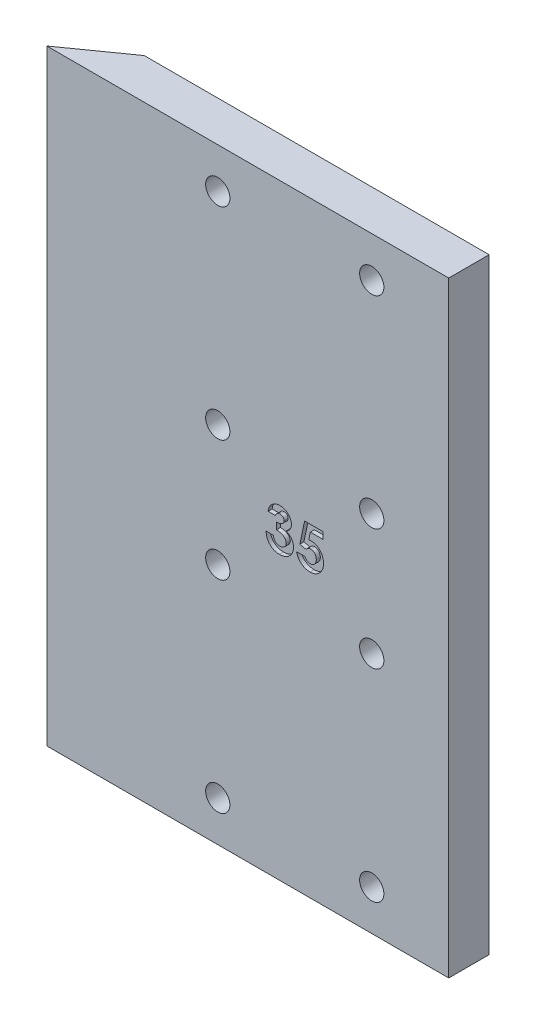
from build123d import *

# Parameters (mm, degrees)
SKETCH1_R           = 3
BOSS_EXTRUDE1_DEPTH = 10
BOSS_EXTRUDE2_DEPTH = 150
CUT_EXTRUDE1_DEPTH  = 1


with BuildPart() as part:
    # Sketch1 → Boss-Extrude1 (new body)
    with BuildSketch(Plane.XY):
        Polygon((38.1, -75), (38.1, 75), (0, 75), (-38.1, 75), (-38.1, -75), (0, -75), align=None)
        with Locations((19.05, 65)):
            Circle(SKETCH1_R, mode=Mode.SUBTRACT)
        with Locations((19.05, 15)):
            Circle(SKETCH1_R, mode=Mode.SUBTRACT)
        with Locations(Location((-19.05, 15, 0), (0, 0, 180))):
            Circle(SKETCH1_R, mode=Mode.SUBTRACT)
        with Locations(Location((-19.05, 65, 0), (0, 0, 180))):
            Circle(SKETCH1_R, mode=Mode.SUBTRACT)
        with Locations(Location((19.05, -65, 0), (0, 0, 180))):
            Circle(SKETCH1_R, mode=Mode.SUBTRACT)
        with Locations(Location((19.05, -15, 0), (0, 0, 180))):
            Circle(SKETCH1_R, mode=Mode.SUBTRACT)
        with Locations((-19.05, -15)):
            Circle(SKETCH1_R, mode=Mode.SUBTRACT)
        with Locations((-19.05, -65)):
            Circle(SKETCH1_R, mode=Mode.SUBTRACT)
    extrude(amount=BOSS_EXTRUDE1_DEPTH)

    # Sketch2 → Boss-Extrude2 (add)
    with BuildSketch(Plane.XZ.offset(75)):
        Polygon((-47.255067051, 0), (-61.346613835, 10), (-38.1, 10), (-38.1, 0), align=None)
    extrude(amount=-BOSS_EXTRUDE2_DEPTH)

    # Sketch3 → Cut-Extrude1 (cut)
    with BuildSketch(Plane.XY.offset(10)):
        with BuildLine():
            Line((-4.80565485, 2.66317523), (-6.600526645, 2.66317523))
            add(Edge.make_bspline(
                [(-6.600526645, 2.66317523), (-6.587854167, 2.752894468), (-6.563010615, 2.928783091), (-6.503563316, 3.183426), (-6.432457931, 3.424972227), (-6.343686491, 3.652656844), (-6.239572034, 3.866885432), (-6.121173288, 4.068393119), (-5.987210317, 4.256314997), (-5.884526281, 4.369519882), (-5.833299081, 4.425995743)],
                knots=[0, 0, 0, 0, 1.111473889, 2.178970933, 3.205615836, 4.199322666, 5.174200091, 6.12565194, 7.064921805, 8, 8, 8, 8], degree=3))
            add(Edge.make_bspline(
                [(-5.833299081, 4.425995743), (-5.759410632, 4.500511549), (-5.613784266, 4.647374371), (-5.370425529, 4.835489423), (-5.115340629, 4.998290208), (-4.843413728, 5.127359848), (-4.558876213, 5.231826769), (-4.259465342, 5.301997435), (-3.946404618, 5.348556292), (-3.732780057, 5.353142502), (-3.623763824, 5.355482922)],
                knots=[0, 0, 0, 0, 1.01925491, 2.00884431, 2.983262333, 3.955970413, 4.92937149, 5.924503185, 6.940838805, 8, 8, 8, 8], degree=3))
            add(Edge.make_bspline(
                [(-3.623763824, 5.355482922), (-3.526842784, 5.353194807), (-3.336315548, 5.348696832), (-3.056288452, 5.312589532), (-2.78930605, 5.249261349), (-2.532546261, 5.16646117), (-2.289785184, 5.053797689), (-2.055664848, 4.923019367), (-1.836726582, 4.76261432), (-1.632458112, 4.58137276), (-1.444798564, 4.385342271), (-1.282284573, 4.175801799), (-1.142568379, 3.958348654), (-1.027460715, 3.731176211), (-0.938958564, 3.493900067), (-0.877535447, 3.247890934), (-0.837332525, 2.99369165), (-0.833327263, 2.82091582), (-0.831295875, 2.73328741)],
                knots=[0, 0, 0, 0, 1.091422571, 2.145516843, 3.172569842, 4.178562979, 5.178154469, 6.181868002, 7.194278174, 8.227918432, 9.254613415, 10.245994977, 11.209837596, 12.161663635, 13.10878368, 14.055455738, 15.013766427, 16, 16, 16, 16], degree=3))
            add(Edge.make_bspline(
                [(-0.831295875, 2.73328741), (-0.835464405, 2.62476692), (-0.843670957, 2.411123439), (-0.911011658, 2.098440333), (-1.016418167, 1.799459482), (-1.168688121, 1.518364079), (-1.359064347, 1.255919109), (-1.5926496, 1.020898893), (-1.862790766, 0.809618633), (-2.065589337, 0.696076596), (-2.169436901, 0.637934845)],
                knots=[0, 0, 0, 0, 0.992805628, 1.954529043, 2.915727527, 3.886831945, 4.871318353, 5.87440735, 6.911542536, 8, 8, 8, 8], degree=3))
            add(Edge.make_bspline(
                [(-2.169436901, 0.637934845), (-2.098157526, 0.614532326), (-1.958096751, 0.568547425), (-1.759017201, 0.477980682), (-1.569715297, 0.379006244), (-1.39345075, 0.264024037), (-1.228470395, 0.137683433), (-1.075779974, -0.001095574), (-0.934467196, -0.152010381), (-0.806838935, -0.315890962), (-0.693563866, -0.490116366), (-0.591928179, -0.670662089), (-0.508276343, -0.860266141), (-0.437412823, -1.056763114), (-0.383461374, -1.261919021), (-0.345474733, -1.474938898), (-0.323517522, -1.695336834), (-0.320168673, -1.844656302), (-0.318475363, -1.920158103)],
                knots=[0, 0, 0, 0, 1.059543567, 2.081955587, 3.086750234, 4.076226789, 5.052108497, 6.020845489, 6.989030705, 7.970690546, 8.952259656, 9.923888338, 10.895517021, 11.877585046, 12.873342345, 13.889638361, 14.932918083, 16, 16, 16, 16], degree=3))
            add(Edge.make_bspline(
                [(-0.318475363, -1.920158103), (-0.321907929, -2.031115096), (-0.328676252, -2.249899688), (-0.37170608, -2.572147002), (-0.451819866, -2.879381186), (-0.55721399, -3.175137432), (-0.697798312, -3.455597636), (-0.863242424, -3.727197975), (-1.06660648, -3.980519426), (-1.292610709, -4.22225915), (-1.543601581, -4.442038084), (-1.815716518, -4.632576529), (-2.102971947, -4.796092416), (-2.40718525, -4.928839272), (-2.728250738, -5.031069533), (-3.065452783, -5.104966279), (-3.420208217, -5.15017753), (-3.662356556, -5.154917072), (-3.78602344, -5.15733759)],
                knots=[0, 0, 0, 0, 1.005138573, 1.981928558, 2.936866704, 3.876260664, 4.820238198, 5.773547, 6.751179199, 7.756627054, 8.768222608, 9.766606018, 10.760583154, 11.757261445, 12.767156078, 13.807575856, 14.880313354, 16, 16, 16, 16], degree=3))
            add(Edge.make_bspline(
                [(-3.78602344, -5.15733759), (-3.903010317, -5.154785563), (-4.131762676, -5.149795412), (-4.466360875, -5.106603123), (-4.784364792, -5.036930455), (-5.086585977, -4.938721053), (-5.371855162, -4.811360242), (-5.642759276, -4.659702093), (-5.89389249, -4.474999316), (-6.128052921, -4.265589744), (-6.340046185, -4.030644094), (-6.529518239, -3.775604766), (-6.692291193, -3.49950195), (-6.829032579, -3.203515272), (-6.938673389, -2.887125482), (-7.025157738, -2.550975975), (-7.085568472, -2.194410019), (-7.103966687, -1.949085056), (-7.113347158, -1.824004257)],
                knots=[0, 0, 0, 0, 1.066544725, 2.085487077, 3.070979577, 4.031932826, 4.977951092, 5.916076795, 6.857635327, 7.814973522, 8.776389752, 9.738577119, 10.707772778, 11.69409279, 12.707140348, 13.757286496, 14.856535458, 16, 16, 16, 16], degree=3))
            Line((-7.113347158, -1.824004257), (-5.318475363, -1.824004257))
            add(Edge.make_bspline(
                [(-5.318475363, -1.824004257), (-5.307101447, -1.886896525), (-5.284947764, -2.009395709), (-5.241738364, -2.186747296), (-5.185430488, -2.350453765), (-5.120324573, -2.501970134), (-5.050000383, -2.643285761), (-4.965031945, -2.76918151), (-4.8716453, -2.883075967), (-4.73688769, -3.018474952), (-4.544242404, -3.157591758), (-4.284107446, -3.278490879), (-3.99473194, -3.349352618), (-3.792429601, -3.357997533), (-3.687866388, -3.362465796)],
                knots=[0, 0, 0, 0, 0.928156231, 1.807827665, 2.648129825, 3.438902246, 4.202261636, 4.936546065, 5.639352463, 6.338805438, 7.70633318, 9.064371875, 10.482673459, 12, 12, 12, 12], degree=3))
            add(Edge.make_bspline(
                [(-3.687866388, -3.362465796), (-3.632381452, -3.361514321), (-3.523698874, -3.359650595), (-3.36406035, -3.338993692), (-3.211982179, -3.304971756), (-3.067181107, -3.258737206), (-2.928735322, -3.200779307), (-2.799289968, -3.126046064), (-2.676206626, -3.039158001), (-2.560823325, -2.941472752), (-2.454206776, -2.835030799), (-2.365495538, -2.717164419), (-2.284419885, -2.597391112), (-2.224455748, -2.467874883), (-2.171914246, -2.335585091), (-2.139756162, -2.195720031), (-2.1154745, -2.051213694), (-2.114063347, -1.952319901), (-2.113347158, -1.902129257)],
                knots=[0, 0, 0, 0, 1.110435564, 2.175094844, 3.216326037, 4.226890168, 5.215276772, 6.21526065, 7.213097102, 8.228249917, 9.239874822, 10.221364777, 11.178138315, 12.128914389, 13.072518965, 14.022636769, 14.996447288, 16, 16, 16, 16], degree=3))
            add(Edge.make_bspline(
                [(-2.113347158, -1.902129257), (-2.115248506, -1.847237237), (-2.119033655, -1.737959802), (-2.149958716, -1.578492363), (-2.198795925, -1.42509754), (-2.266636773, -1.278454636), (-2.357230664, -1.139104148), (-2.464130446, -1.004250283), (-2.595758052, -0.880911945), (-2.740171164, -0.758995736), (-2.907633641, -0.652721571), (-3.089989826, -0.554646132), (-3.292032322, -0.476608361), (-3.508829092, -0.406906177), (-3.744481048, -0.355996784), (-3.99752488, -0.319031603), (-4.267552391, -0.291516755), (-4.453685864, -0.287569297), (-4.549244593, -0.285542719)],
                knots=[0, 0, 0, 0, 0.809814727, 1.612155564, 2.388397, 3.182215007, 3.988903953, 4.837162975, 5.715530372, 6.646997145, 7.623086902, 8.637258368, 9.698941581, 10.815059213, 11.996518529, 13.252603015, 14.589518788, 16, 16, 16, 16], degree=3))
            Line((-4.549244593, -0.285542719), (-4.549244593, 1.381123948))
            add(Edge.make_bspline(
                [(-4.549244593, 1.381123948), (-4.430268292, 1.391256351), (-4.207687193, 1.410212069), (-3.898732693, 1.454540676), (-3.638632831, 1.513793157), (-3.4211361, 1.585278069), (-3.240540751, 1.677083319), (-3.082773652, 1.778432262), (-2.946897163, 1.896134247), (-2.832063302, 2.026679417), (-2.740199787, 2.166872688), (-2.675184142, 2.314535042), (-2.632251207, 2.465097622), (-2.628183315, 2.568077889), (-2.62616767, 2.619104717)],
                knots=[0, 0, 0, 0, 1.70044513, 3.18119609, 4.440695891, 5.496282586, 6.431922213, 7.318171381, 8.16090191, 8.983045123, 9.787564368, 10.536848927, 11.275007137, 12, 12, 12, 12], degree=3))
            add(Edge.make_bspline(
                [(-2.62616767, 2.619104717), (-2.629645235, 2.68420941), (-2.636432704, 2.811279986), (-2.689147867, 2.993144749), (-2.780655418, 3.155262112), (-2.903350976, 3.297290934), (-3.052859779, 3.415924051), (-3.228110305, 3.502049671), (-3.425299609, 3.552652318), (-3.564032908, 3.557898108), (-3.635783055, 3.560611127)],
                knots=[0, 0, 0, 0, 1.009664648, 1.970651636, 2.907870547, 3.878035693, 4.867062054, 5.849714035, 6.887914197, 8, 8, 8, 8], degree=3))
            add(Edge.make_bspline(
                [(-3.635783055, 3.560611127), (-3.700816496, 3.55741005), (-3.829862761, 3.551058131), (-4.018567025, 3.503649091), (-4.197773207, 3.423841872), (-4.363770452, 3.313792421), (-4.514162555, 3.181627695), (-4.637591082, 3.02510601), (-4.740253078, 2.853604852), (-4.783768795, 2.726900616), (-4.80565485, 2.66317523)],
                knots=[0, 0, 0, 0, 0.98818071, 1.960853194, 2.938124878, 3.957524365, 4.978590984, 5.968022688, 6.978025184, 8, 8, 8, 8], degree=3))
        make_face()
        with BuildLine():
            Line((2.435931689, 5.099072666), (6.989216945, 5.099072666))
            Line((6.989216945, 5.099072666), (6.989216945, 3.432405999))
            Line((6.989216945, 3.432405999), (3.85820733, 3.432405999))
            Line((3.85820733, 3.432405999), (3.46758233, 1.541380358))
            add(Edge.make_bspline(
                [(3.46758233, 1.541380358), (3.520810578, 1.556205097), (3.625787619, 1.585442529), (3.783935662, 1.614763973), (3.937203154, 1.633769201), (4.037776348, 1.636304245), (4.086572714, 1.637534204)],
                knots=[0, 0, 0, 0, 1.05461699, 2.079921384, 3.068411212, 4, 4, 4, 4], degree=3))
            add(Edge.make_bspline(
                [(4.086572714, 1.637534204), (4.192905108, 1.635097659), (4.40250968, 1.630294692), (4.709134572, 1.584698866), (5.002746019, 1.512886822), (5.282445538, 1.41046803), (5.547959901, 1.277167328), (5.799610963, 1.115910845), (6.037707584, 0.926415357), (6.258020164, 0.708562223), (6.460452566, 0.469354549), (6.636455994, 0.210626139), (6.786773905, -0.063933792), (6.906331574, -0.356031902), (7.000696679, -0.663833619), (7.068887012, -0.987536192), (7.109211362, -1.327523257), (7.114648853, -1.559472123), (7.117422073, -1.677770283)],
                knots=[0, 0, 0, 0, 1.01440847, 1.999622559, 2.951875003, 3.895578053, 4.836219714, 5.782137149, 6.743708247, 7.735272588, 8.734977101, 9.730283169, 10.717124674, 11.717316708, 12.737475749, 13.78628267, 14.87096371, 16, 16, 16, 16], degree=3))
            add(Edge.make_bspline(
                [(7.117422073, -1.677770283), (7.114033154, -1.797411401), (7.107345825, -2.0334983), (7.063717134, -2.380629551), (6.986711711, -2.713102923), (6.880937058, -3.031808441), (6.741585723, -3.334403693), (6.57399667, -3.624023343), (6.375336422, -3.898517635), (6.147554515, -4.155072669), (5.899925703, -4.389568895), (5.636259473, -4.595855675), (5.358408159, -4.769444329), (5.066365058, -4.909733309), (4.761805713, -5.020727453), (4.444637688, -5.101525891), (4.113319587, -5.147859306), (3.888397644, -5.154143444), (3.774072714, -5.15733759)],
                knots=[0, 0, 0, 0, 1.06808661, 2.107647099, 3.116961351, 4.110378221, 5.100014249, 6.085620622, 7.093190682, 8.119403071, 9.144090782, 10.133780668, 11.103064255, 12.062861538, 13.020824475, 13.992378307, 14.979551724, 16, 16, 16, 16], degree=3))
            add(Edge.make_bspline(
                [(3.774072714, -5.15733759), (3.671835333, -5.15472458), (3.470201821, -5.149571176), (3.17320451, -5.11789564), (2.886866121, -5.061892997), (2.612706799, -4.980842671), (2.347841929, -4.881088222), (2.095333424, -4.756326432), (1.853793707, -4.608932933), (1.623908659, -4.441597661), (1.409413586, -4.253100967), (1.213645211, -4.046758858), (1.035418329, -3.825172176), (0.878546714, -3.585607215), (0.743522114, -3.328417919), (0.623779543, -3.056635321), (0.52576905, -2.767421146), (0.476031547, -2.566921812), (0.450755407, -2.465029898)],
                knots=[0, 0, 0, 0, 1.054957082, 2.080596141, 3.077793124, 4.061112343, 5.027190972, 5.994718051, 6.962465889, 7.943658696, 8.924948258, 9.904494768, 10.875059, 11.855380583, 12.854004648, 13.869083016, 14.917087635, 16, 16, 16, 16], degree=3))
            Line((0.450755407, -2.465029898), (2.502037458, -2.465029898))
            add(Edge.make_bspline(
                [(2.502037458, -2.465029898), (2.539534943, -2.535636845), (2.612407027, -2.672853388), (2.751025841, -2.855028967), (2.906200802, -3.010380475), (3.076532149, -3.140425728), (3.263123522, -3.237853419), (3.458371675, -3.311738072), (3.664729429, -3.354433277), (3.80526817, -3.359770601), (3.876236176, -3.362465796)],
                knots=[0, 0, 0, 0, 1.104910296, 2.147267069, 3.153527244, 4.136738762, 5.099945312, 6.05603338, 7.018353, 8, 8, 8, 8], degree=3))
            add(Edge.make_bspline(
                [(3.876236176, -3.362465796), (3.925699924, -3.36060474), (4.023020681, -3.356943083), (4.166407427, -3.337571995), (4.303276376, -3.300883595), (4.434645116, -3.250078689), (4.560866536, -3.186719234), (4.680131208, -3.106732049), (4.794514123, -3.014663834), (4.902273909, -2.909015245), (4.999873215, -2.791241644), (5.085457131, -2.66468588), (5.161980953, -2.53216005), (5.218663319, -2.388414475), (5.265081383, -2.237741446), (5.299265523, -2.079004393), (5.319694402, -1.912017922), (5.32158557, -1.798020939), (5.322550278, -1.739869642)],
                knots=[0, 0, 0, 0, 0.978869489, 1.925942215, 2.855067702, 3.774946051, 4.70828698, 5.642468714, 6.60995405, 7.609372294, 8.622401667, 9.629904756, 10.629323, 11.642352373, 12.678539694, 13.745912462, 14.850161547, 16, 16, 16, 16], degree=3))
            add(Edge.make_bspline(
                [(5.322550278, -1.739869642), (5.321430623, -1.683068168), (5.319251185, -1.572502721), (5.301222446, -1.41015304), (5.268969379, -1.256112575), (5.225024297, -1.109201489), (5.168769347, -0.970311899), (5.100022037, -0.838617067), (5.018488672, -0.714782661), (4.923731517, -0.601329829), (4.822683462, -0.497267665), (4.714125381, -0.406255725), (4.599035326, -0.330722135), (4.480989576, -0.264779112), (4.355276172, -0.216787218), (4.224721903, -0.183736971), (4.089464064, -0.15948603), (3.997207626, -0.158061198), (3.950354766, -0.15733759)],
                knots=[0, 0, 0, 0, 1.166249705, 2.270133367, 3.348514167, 4.393962215, 5.415026464, 6.420877785, 7.440098956, 8.453121383, 9.451844239, 10.415694839, 11.355045125, 12.27538808, 13.187007209, 14.108269027, 15.039275622, 16, 16, 16, 16], degree=3))
            add(Edge.make_bspline(
                [(3.950354766, -0.15733759), (3.899461669, -0.159268701), (3.797460986, -0.16313906), (3.6459135, -0.19463114), (3.496193256, -0.245597138), (3.347467654, -0.31591281), (3.201213055, -0.407933837), (3.053569727, -0.515863952), (2.909479609, -0.647545301), (2.817863105, -0.745621869), (2.770466945, -0.796360026)],
                knots=[0, 0, 0, 0, 0.88288272, 1.769486374, 2.674910571, 3.623812639, 4.617874466, 5.670434592, 6.794841017, 8, 8, 8, 8], degree=3))
            Line((2.770466945, -0.796360026), (1.260050278, -0.449805539))
            Line((1.260050278, -0.449805539), (2.435931689, 5.099072666))
        make_face()
    extrude(amount=-CUT_EXTRUDE1_DEPTH, mode=Mode.SUBTRACT)


solid = part.part
